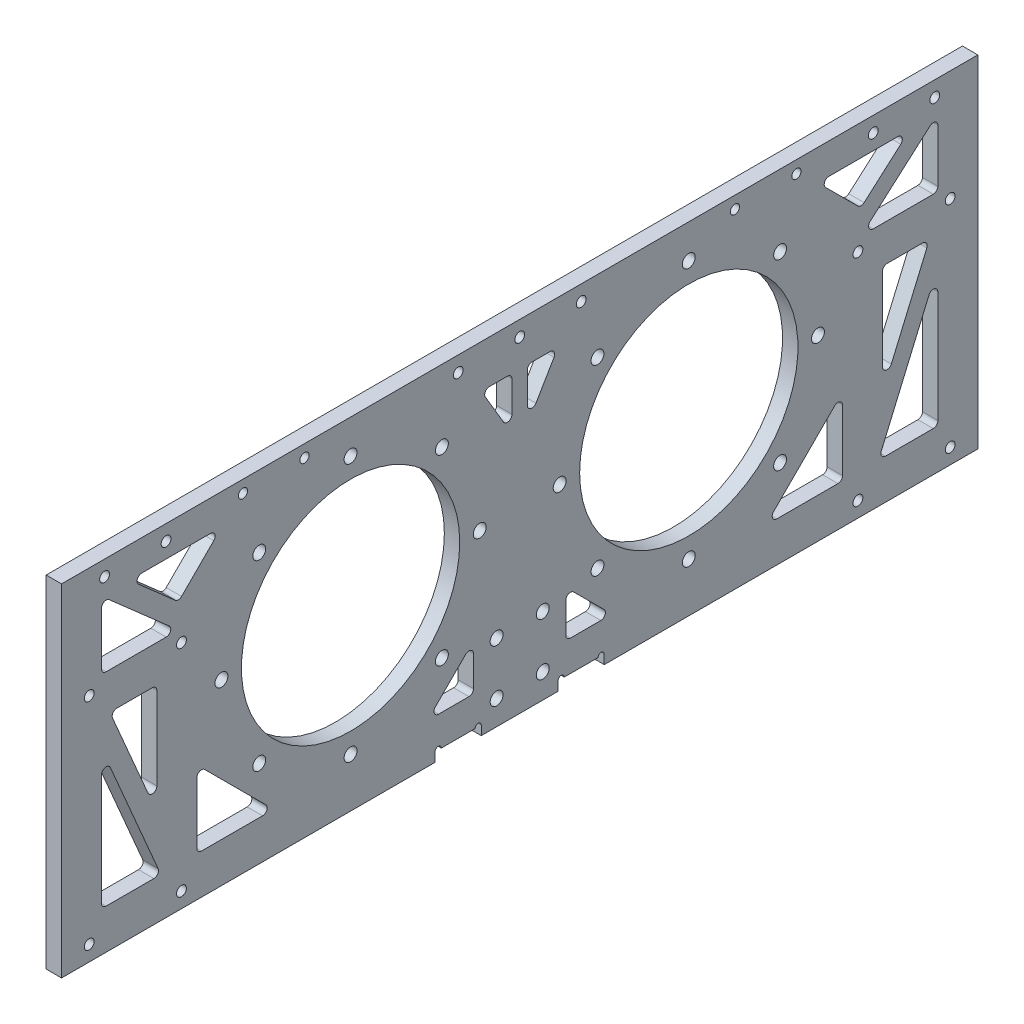
from build123d import *

# Parameters (mm, degrees)
SKETCH_1_W          = 298
SKETCH_1_H          = 111
SKETCH_1_R          = 35.5
SKETCH_1_R_2        = 2.1
SKETCH_1_R_3        = 1.5
EXTRUDE_1_DEPTH     = 5
SKETCH_2_R          = 1.6
CUT_EXTRUDE_1_DEPTH = 213.143819142
SKETCH_3_R          = 1.6
CUT_EXTRUDE_2_DEPTH = 10
CUT_EXTRUDE_3_DEPTH = 213.143819142
CUT_EXTRUDE_4_DEPTH = 213.143819142


with BuildPart() as part:
    # 草图1 → 凸台-拉伸1 (new body)
    with BuildSketch(Plane(origin=(0, 0, 0), x_dir=(0, 0, -1), z_dir=(1, 0, 0))):
        with Locations((55, -2.5)):
            Rectangle(SKETCH_1_W, SKETCH_1_H)
        Circle(SKETCH_1_R, mode=Mode.SUBTRACT)
        with Locations((0, 42)):
            Circle(SKETCH_1_R_2, mode=Mode.SUBTRACT)
        with Locations(Location((110, 42, 0), (0, 0, 180))):
            Circle(SKETCH_1_R_2, mode=Mode.SUBTRACT)
        with Locations(Location((110, 0, 0), (0, 0, 180))):
            Circle(SKETCH_1_R, mode=Mode.SUBTRACT)
        with Locations((62.5, -33)):
            Circle(SKETCH_1_R_2, mode=Mode.SUBTRACT)
        with Locations((47.5, -33)):
            Circle(SKETCH_1_R_2, mode=Mode.SUBTRACT)
        with Locations((47.5, -50)):
            Circle(SKETCH_1_R_2, mode=Mode.SUBTRACT)
        with Locations((62.5, -50)):
            Circle(SKETCH_1_R_2, mode=Mode.SUBTRACT)
        with Locations((-15, 49)):
            Circle(SKETCH_1_R_3, mode=Mode.SUBTRACT)
        with Locations((-35, 49)):
            Circle(SKETCH_1_R_3, mode=Mode.SUBTRACT)
        with Locations(Location((125, 49, 0), (0, 0, 180))):
            Circle(SKETCH_1_R_3, mode=Mode.SUBTRACT)
        with Locations(Location((145, 49, 0), (0, 0, 180))):
            Circle(SKETCH_1_R_3, mode=Mode.SUBTRACT)
        with Locations((29.69848481, 29.69848481)):
            Circle(SKETCH_1_R_2, mode=Mode.SUBTRACT)
        with Locations((42, 0)):
            Circle(SKETCH_1_R_2, mode=Mode.SUBTRACT)
        with Locations((29.69848481, -29.69848481)):
            Circle(SKETCH_1_R_2, mode=Mode.SUBTRACT)
        with Locations((0, -42)):
            Circle(SKETCH_1_R_2, mode=Mode.SUBTRACT)
        with Locations((-29.69848481, -29.69848481)):
            Circle(SKETCH_1_R_2, mode=Mode.SUBTRACT)
        with Locations((-42, 0)):
            Circle(SKETCH_1_R_2, mode=Mode.SUBTRACT)
        with Locations((-29.69848481, 29.69848481)):
            Circle(SKETCH_1_R_2, mode=Mode.SUBTRACT)
        with Locations(Location((139.69848481, 29.69848481, 0), (0, 0, 180))):
            Circle(SKETCH_1_R_2, mode=Mode.SUBTRACT)
        with Locations(Location((152, 0, 0), (0, 0, 180))):
            Circle(SKETCH_1_R_2, mode=Mode.SUBTRACT)
        with Locations(Location((139.69848481, -29.69848481, 0), (0, 0, 180))):
            Circle(SKETCH_1_R_2, mode=Mode.SUBTRACT)
        with Locations(Location((110, -42, 0), (0, 0, 180))):
            Circle(SKETCH_1_R_2, mode=Mode.SUBTRACT)
        with Locations(Location((80.30151519, -29.69848481, 0), (0, 0, 180))):
            Circle(SKETCH_1_R_2, mode=Mode.SUBTRACT)
        with Locations(Location((68, 0, 0), (0, 0, 180))):
            Circle(SKETCH_1_R_2, mode=Mode.SUBTRACT)
        with Locations(Location((80.30151519, 29.69848481, 0), (0, 0, 180))):
            Circle(SKETCH_1_R_2, mode=Mode.SUBTRACT)
    extrude(amount=EXTRUDE_1_DEPTH)

    # 草图2 → 切除-拉伸1 (cut, through all)
    with BuildSketch(Plane(origin=(5, 0, 0), x_dir=(0, 0, -1), z_dir=(1, 0, 0))):
        with Locations((-80, 48)):
            Circle(SKETCH_2_R)
        with Locations((-60, 48)):
            Circle(SKETCH_2_R)
        with Locations(Location((170, 48, 0), (0, 0, 180))):
            Circle(SKETCH_2_R)
        with Locations(Location((190, 48, 0), (0, 0, 180))):
            Circle(SKETCH_2_R)
        with Locations((35, 48)):
            Circle(SKETCH_2_R)
        with Locations((55, 48)):
            Circle(SKETCH_2_R)
        with Locations(Location((75, 48, 0), (0, 0, 180))):
            Circle(SKETCH_2_R)
    extrude(amount=-CUT_EXTRUDE_1_DEPTH, mode=Mode.SUBTRACT)

    # 草图3 → 切除-拉伸2 (cut)
    with BuildSketch(Plane(origin=(5, 0, 0), x_dir=(0, 0, -1), z_dir=(1, 0, 0))):
        with Locations((-85, -53)):
            Circle(SKETCH_3_R)
        with Locations((-55, -53)):
            Circle(SKETCH_3_R)
        with Locations((-85, 17)):
            Circle(SKETCH_3_R)
        with Locations((-55, 17)):
            Circle(SKETCH_3_R)
        with Locations(Location((165, 17, 0), (0, 0, 180))):
            Circle(SKETCH_3_R)
        with Locations(Location((195, 17, 0), (0, 0, 180))):
            Circle(SKETCH_3_R)
        with Locations(Location((165, -53, 0), (0, 0, 180))):
            Circle(SKETCH_3_R)
        with Locations(Location((195, -53, 0), (0, 0, 180))):
            Circle(SKETCH_3_R)
    extrude(amount=-CUT_EXTRUDE_2_DEPTH, mode=Mode.SUBTRACT)

    # 草图4 → 切除-拉伸3 (cut, through all)
    with BuildSketch(Plane(origin=(5, 0, 0), x_dir=(0, 0, -1), z_dir=(1, 0, 0))):
        with BuildLine():
            Line((45.122624964, 39), (51, 39))
            ThreePointArc((51, 39), (52.060660172, 38.560660172), (52.5, 37.5))
            Line((52.5, 37.5), (52.5, 27.508462438))
            ThreePointArc((52.5, 27.508462438), (51.394111669, 26.061162887), (49.707098677, 26.747932249))
            Line((49.707098677, 26.747932249), (43.829723641, 36.73946981))
            ThreePointArc((43.829723641, 36.73946981), (43.820550603, 38.244716293), (45.122624964, 39))
        make_face()
        with BuildLine():
            Line((57.5, 37.5), (57.5, 27.508462438))
            ThreePointArc((57.5, 27.508462438), (58.605888331, 26.061162887), (60.292901323, 26.747932249))
            Line((60.292901323, 26.747932249), (66.170276359, 36.73946981))
            ThreePointArc((66.170276359, 36.73946981), (66.179449397, 38.244716293), (64.877375036, 39))
            Line((64.877375036, 39), (59, 39))
            ThreePointArc((59, 39), (57.939339828, 38.560660172), (57.5, 37.5))
        make_face()
        with BuildLine():
            Line((-81, -7.256992992), (-81, -43.5))
            ThreePointArc((-81, -43.5), (-80.560660172, -44.560660172), (-79.5, -45))
            Line((-79.5, -45), (-63.967282711, -45))
            ThreePointArc((-63.967282711, -45), (-62.715021073, -44.325736513), (-62.588565166, -42.909121052))
            Line((-62.588565166, -42.909121052), (-78.121282455, -6.666114044))
            ThreePointArc((-78.121282455, -6.666114044), (-79.801598808, -5.787626408), (-81, -7.256992992))
        make_face()
        with BuildLine():
            Line((-76.032717289, 9), (-64.5, 9))
            ThreePointArc((-64.5, 9), (-63.439339828, 8.560660172), (-63, 7.5))
            Line((-63, 7.5), (-63, -19.409673675))
            ThreePointArc((-63, -19.409673675), (-64.198401192, -20.879040259), (-65.878717545, -20.000552622))
            Line((-65.878717545, -20.000552622), (-77.411434834, 6.909121052))
            ThreePointArc((-77.411434834, 6.909121052), (-77.284978927, 8.325736513), (-76.032717289, 9))
        make_face()
        with BuildLine():
            Line((-50, -23.621320344), (-50, -43.5))
            ThreePointArc((-50, -43.5), (-49.560660172, -44.560660172), (-48.5, -45))
            Line((-48.5, -45), (-28.621320344, -45))
            ThreePointArc((-28.621320344, -45), (-27.235501045, -44.074025149), (-27.560660172, -42.439339828))
            Line((-27.560660172, -42.439339828), (-47.439339828, -22.560660172))
            ThreePointArc((-47.439339828, -22.560660172), (-49.074025149, -22.235501045), (-50, -23.621320344))
        make_face()
        with BuildLine():
            Line((-81, 39.681900903), (-81, 22.5))
            ThreePointArc((-81, 22.5), (-80.560660172, 21.439339828), (-79.5, 21))
            Line((-79.5, 21), (-59.97511261, 21))
            ThreePointArc((-59.97511261, 21), (-58.571705076, 21.970427254), (-58.984170767, 23.626070275))
            Line((-58.984170767, 23.626070275), (-78.509058158, 40.807971179))
            ThreePointArc((-78.509058158, 40.807971179), (-80.117894504, 41.048724367), (-81, 39.681900903))
        make_face()
        with BuildLine():
            Line((-67.942618769, 43), (-45.539051722, 43))
            ThreePointArc((-45.539051722, 43), (-44.153232424, 42.074025149), (-44.478391551, 40.439339828))
            Line((-44.478391551, 40.439339828), (-54.965167615, 29.952563764))
            ThreePointArc((-54.965167615, 29.952563764), (-55.978028396, 29.513985723), (-57.016769629, 29.88715366))
            Line((-57.016769629, 29.88715366), (-68.933560611, 40.373929725))
            ThreePointArc((-68.933560611, 40.373929725), (-69.346026303, 42.029572746), (-67.942618769, 43))
        make_face()
        with BuildLine():
            Line((28.621320344, -45), (38.5, -45))
            ThreePointArc((38.5, -45), (39.560660172, -44.560660172), (40, -43.5))
            Line((40, -43.5), (40, -33.621320344))
            ThreePointArc((40, -33.621320344), (39.074025149, -32.235501045), (37.439339828, -32.560660172))
            Line((37.439339828, -32.560660172), (27.560660172, -42.439339828))
            ThreePointArc((27.560660172, -42.439339828), (27.235501045, -44.074025149), (28.621320344, -45))
        make_face()
        with BuildLine():
            Line((72.560660172, -32.560660172), (82.439339828, -42.439339828))
            ThreePointArc((82.439339828, -42.439339828), (82.764498955, -44.074025149), (81.378679656, -45))
            Line((81.378679656, -45), (71.5, -45))
            ThreePointArc((71.5, -45), (70.439339828, -44.560660172), (70, -43.5))
            Line((70, -43.5), (70, -33.621320344))
            ThreePointArc((70, -33.621320344), (70.925974851, -32.235501045), (72.560660172, -32.560660172))
        make_face()
        with BuildLine():
            Line((167.016769629, 29.88715366), (178.933560611, 40.373929725))
            ThreePointArc((178.933560611, 40.373929725), (179.346026303, 42.029572746), (177.942618769, 43))
            Line((177.942618769, 43), (155.539051722, 43))
            ThreePointArc((155.539051722, 43), (154.153232424, 42.074025149), (154.478391551, 40.439339828))
            Line((154.478391551, 40.439339828), (164.965167615, 29.952563764))
            ThreePointArc((164.965167615, 29.952563764), (165.978028396, 29.513985723), (167.016769629, 29.88715366))
        make_face()
        with BuildLine():
            Line((168.984170767, 23.626070275), (188.509058158, 40.807971179))
            ThreePointArc((188.509058158, 40.807971179), (190.117894504, 41.048724367), (191, 39.681900903))
            Line((191, 39.681900903), (191, 22.5))
            ThreePointArc((191, 22.5), (190.560660172, 21.439339828), (189.5, 21))
            Line((189.5, 21), (169.97511261, 21))
            ThreePointArc((169.97511261, 21), (168.571705076, 21.970427254), (168.984170767, 23.626070275))
        make_face()
        with BuildLine():
            Line((137.560660172, -42.439339828), (157.439339828, -22.560660172))
            ThreePointArc((157.439339828, -22.560660172), (159.074025149, -22.235501045), (160, -23.621320344))
            Line((160, -23.621320344), (160, -43.5))
            ThreePointArc((160, -43.5), (159.560660172, -44.560660172), (158.5, -45))
            Line((158.5, -45), (138.621320344, -45))
            ThreePointArc((138.621320344, -45), (137.235501045, -44.074025149), (137.560660172, -42.439339828))
        make_face()
        with BuildLine():
            Line((175.878717545, -20.000552622), (187.411434834, 6.909121052))
            ThreePointArc((187.411434834, 6.909121052), (187.284978927, 8.325736513), (186.032717289, 9))
            Line((186.032717289, 9), (174.5, 9))
            ThreePointArc((174.5, 9), (173.439339828, 8.560660172), (173, 7.5))
            Line((173, 7.5), (173, -19.409673675))
            ThreePointArc((173, -19.409673675), (174.198401192, -20.879040259), (175.878717545, -20.000552622))
        make_face()
        with BuildLine():
            Line((172.588565166, -42.909121052), (188.121282455, -6.666114044))
            ThreePointArc((188.121282455, -6.666114044), (189.801598808, -5.787626408), (191, -7.256992992))
            Line((191, -7.256992992), (191, -43.5))
            ThreePointArc((191, -43.5), (190.560660172, -44.560660172), (189.5, -45))
            Line((189.5, -45), (173.967282711, -45))
            ThreePointArc((173.967282711, -45), (172.715021073, -44.325736513), (172.588565166, -42.909121052))
        make_face()
    extrude(amount=-CUT_EXTRUDE_3_DEPTH, mode=Mode.SUBTRACT)

    # 草图6 → 切除-拉伸4 (cut, through all)
    with BuildSketch(Plane(origin=(5, 0, 0), x_dir=(0, 0, -1), z_dir=(1, 0, 0))):
        with BuildLine():
            Line((42.5, -58), (42.5, -55))
            ThreePointArc((42.5, -55), (41.5, -54), (40.5, -55))
            Line((40.5, -55), (29.5, -55))
            ThreePointArc((29.5, -55), (28.5, -54), (27.5, -55))
            Line((27.5, -55), (27.5, -58))
            Line((27.5, -58), (42.5, -58))
        make_face()
        with BuildLine():
            Line((82.5, -58), (67.5, -58))
            Line((67.5, -58), (67.5, -55))
            ThreePointArc((67.5, -55), (68.5, -54), (69.5, -55))
            Line((69.5, -55), (80.5, -55))
            ThreePointArc((80.5, -55), (81.5, -54), (82.5, -55))
            Line((82.5, -55), (82.5, -58))
        make_face()
    extrude(amount=-CUT_EXTRUDE_4_DEPTH, mode=Mode.SUBTRACT)


solid = part.part
